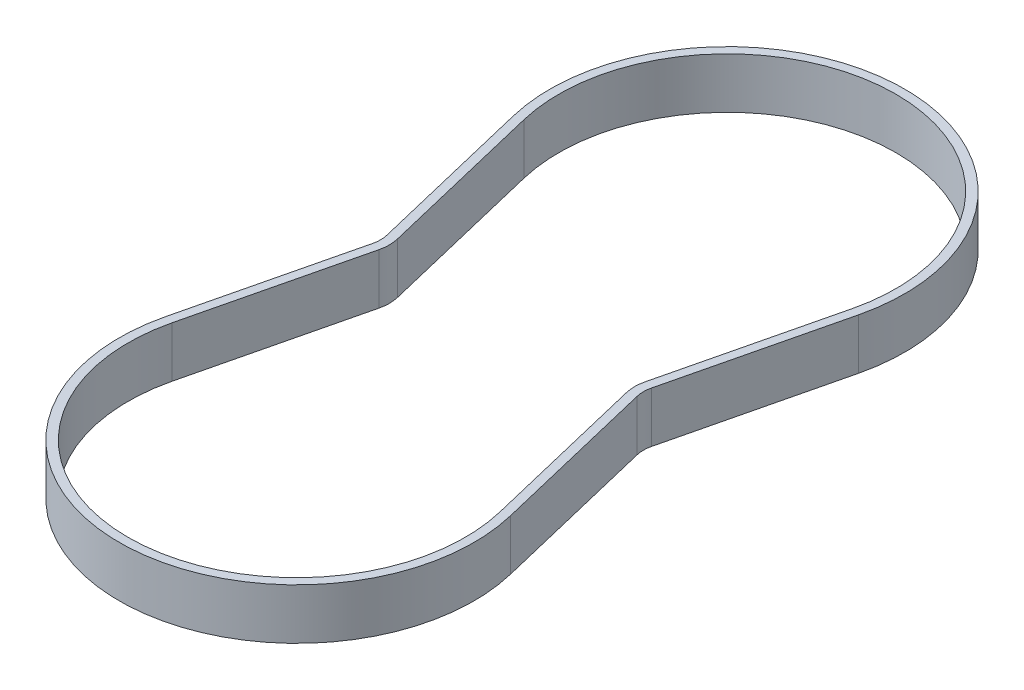
from build123d import *

# Parameters (mm, degrees)
EXTRUDE_1_DEPTH = 10


with BuildPart() as part:
    # 草图1 → 凸台-拉伸1 (new body)
    with BuildSketch(Plane(origin=(0, 0, 0), x_dir=(1, 0, 0), z_dir=(0, 1, 0))):
        with BuildLine():
            Line((-34.029030394, 34.313114728), (-26.111451933, 1.403466047))
            ThreePointArc((-26.111451933, 1.403466047), (-25.945, 0), (-26.111451933, -1.403466047))
            Line((-26.111451933, -1.403466047), (-34.029030394, -34.313114728))
            ThreePointArc((-34.029030394, -34.313114728), (0, -77.5), (34.029030394, -34.313114728))
            Line((34.029030394, -34.313114728), (26.111451933, -1.403466047))
            ThreePointArc((26.111451933, -1.403466047), (25.945, 0), (26.111451933, 1.403466047))
            Line((26.111451933, 1.403466047), (34.029030394, 34.313114728))
            ThreePointArc((34.029030394, 34.313114728), (0, 77.5), (-34.029030394, 34.313114728))
        make_face()
        with BuildLine():
            Line((-32.337301454, 34.720119881), (-24.419722993, 1.8104712))
            ThreePointArc((-24.419722993, 1.8104712), (-24.205, 0), (-24.419722993, -1.8104712))
            Line((-24.419722993, -1.8104712), (-32.337301454, -34.720119881))
            ThreePointArc((-32.337301454, -34.720119881), (0, -75.76), (32.337301454, -34.720119881))
            Line((32.337301454, -34.720119881), (24.419722993, -1.8104712))
            ThreePointArc((24.419722993, -1.8104712), (24.205, 0), (24.419722993, 1.8104712))
            Line((24.419722993, 1.8104712), (32.337301454, 34.720119881))
            ThreePointArc((32.337301454, 34.720119881), (0, 75.76), (-32.337301454, 34.720119881))
        make_face(mode=Mode.SUBTRACT)
    extrude(amount=EXTRUDE_1_DEPTH)


solid = part.part
